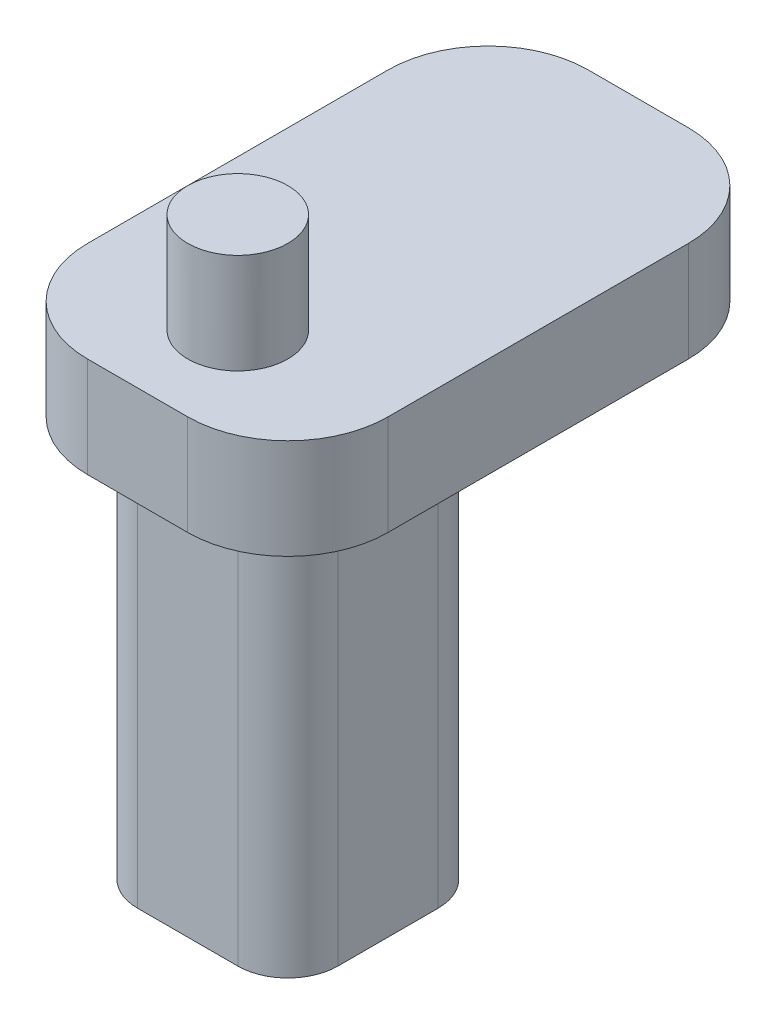
from build123d import *

# Parameters (mm, degrees)
SKETCH1_W           = 30
SKETCH1_H           = 50
BOSS_EXTRUDE1_DEPTH = 10
SKETCH2_R           = 5
BOSS_EXTRUDE2_DEPTH = 10
FILLET1_R           = 10
FILLET2_R           = 10
BOSS_EXTRUDE3_DEPTH = 40


with BuildPart() as part:
    # Sketch1 → Boss-Extrude1 (new body)
    with BuildSketch(Plane(origin=(0, 0, 0), x_dir=(1, 0, 0), z_dir=(0, 1, 0))):
        Rectangle(SKETCH1_W, SKETCH1_H)
    extrude(amount=BOSS_EXTRUDE1_DEPTH)

    # Sketch2 → Boss-Extrude2 (add)
    with BuildSketch(Plane(origin=(0, 10, 0), x_dir=(1, 0, 0), z_dir=(0, 1, 0))):
        with Locations(Location((0, -15, 0), (0, 0, 90))):
            Circle(SKETCH2_R)
    extrude(amount=BOSS_EXTRUDE2_DEPTH)

    # Fillet1
    fillet1_edges = [part.edges().sort_by_distance(p)[0] for p in [
        (-15, 5, -25),
        (15, 5, -25),
    ]]
    fillet(fillet1_edges, radius=FILLET1_R)

    # Fillet2
    fillet2_edges = [part.edges().sort_by_distance(p)[0] for p in [
        (15, 5, 25),
        (-15, 5, 25),
    ]]
    fillet(fillet2_edges, radius=FILLET2_R)

    # Sketch3 → Boss-Extrude3 (add)
    with BuildSketch(Plane.XZ):
        with BuildLine():
            Line((10, 15), (10, 5))
            ThreePointArc((10, 5), (8.535533906, 1.464466094), (5, 0))
            Line((5, 0), (-5, 0))
            ThreePointArc((-5, 0), (-8.535533906, 1.464466094), (-10, 5))
            Line((-10, 5), (-10, 15))
            ThreePointArc((-10, 15), (-8.535533906, 18.535533906), (-5, 20))
            Line((-5, 20), (5, 20))
            ThreePointArc((5, 20), (8.535533906, 18.535533906), (10, 15))
        make_face()
    extrude(amount=BOSS_EXTRUDE3_DEPTH)


solid = part.part
